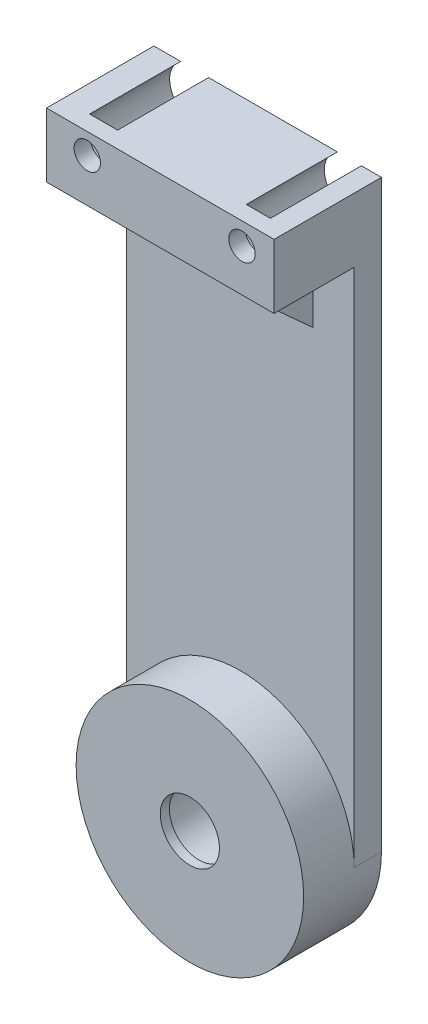
from build123d import *

# Parameters (mm, degrees)
ESBO_O2_R                           = 12.5
RESSALTO_EXTRUS_O1_DEPTH            = 5.55
RESSALTO_EXTRUS_O3_DEPTH            = 3
ESBO_O5_W                           = 25
ESBO_O5_H                           = 7.051040728
RESSALTO_EXTRUS_O4_DEPTH            = 11.8
REBAIXO_PARA_SHCS_M2_51_D           = 2.9
REBAIXO_PARA_SHCS_M2_51_CBORE_D     = 5.5
REBAIXO_PARA_SHCS_M2_51_CBORE_DEPTH = 10
NERVURA1_REACH                      = 67.976
ESBO_O10_WALL_W                     = 145.845066172
ESBO_O10_WALL_H                     = 15
CORTE_EXTRUS_O1_REACH               = 68.009
ESBO_O11_W                          = 9
ESBO_O11_H                          = 8
ESBO_O12_R                          = 3.25
CORTE_EXTRUS_O2_DEPTH               = 67.475439137
ESBO_O13_R                          = 4
CORTE_EXTRUS_O3_DEPTH               = 7.55


with BuildPart() as part:
    # Esboço2 → Ressalto-extrusão1 (new body)
    with BuildSketch(Plane.XY):
        with Locations((-0.474928023, -0.063425095)):
            Circle(ESBO_O2_R)
    extrude(amount=-RESSALTO_EXTRUS_O1_DEPTH)

    # Esboço4 → Ressalto-extrusão3 (add)
    with BuildSketch(Plane(origin=(0, 0, -5.55), x_dir=(-1, 0, 0), z_dir=(0, 0, -1))):
        with BuildLine():
            Line((-12.025071977, -0.063425095), (-12.025071977, 64.120162595))
            Line((-12.025071977, 64.120162595), (12.974928023, 64.120162595))
            Line((12.974928023, 64.120162595), (12.974928023, -0.063425095))
            ThreePointArc((12.974928023, -0.063425095), (0.474928023, -12.563425095), (-12.025071977, -0.063425095))
        make_face()
    extrude(amount=RESSALTO_EXTRUS_O3_DEPTH)

    # Esboço5 → Ressalto-extrusão4 (add)
    with BuildSketch(Plane(origin=(0, 0, -8.55), x_dir=(-1, 0, 0), z_dir=(0, 0, -1))):
        with Locations((0.474928023, 60.594642231)):
            Rectangle(ESBO_O5_W, ESBO_O5_H)
    extrude(amount=-RESSALTO_EXTRUS_O4_DEPTH)

    # Rebaixo para SHCS M2.51 (through all)
    with Locations(Plane(origin=(0, 0, -8.55), x_dir=(-1, 0, 0), z_dir=(0, 0, -1))):
        with Locations((-8.49949915, 61.707782077), (8.5, 61.838275999)):
            CounterBoreHole(REBAIXO_PARA_SHCS_M2_51_D / 2, REBAIXO_PARA_SHCS_M2_51_CBORE_D / 2, REBAIXO_PARA_SHCS_M2_51_CBORE_DEPTH)

    # Esboço10 wall → Nervura1 (add, up to next)
    with BuildSketch(Plane(origin=(0, 53.069121867, -1.15), x_dir=(0, -0.672672793996, -0.739940073396), z_dir=(0, 0.739940073396, -0.672672793996)), mode=Mode.PRIVATE) as nervura1_sk1:
        Rectangle(ESBO_O10_WALL_W, ESBO_O10_WALL_H)
    nervura1_tool1 = extrude(nervura1_sk1.sketch, amount=NERVURA1_REACH, mode=Mode.PRIVATE) - part.part
    add(nervura1_tool1.solids().sort_by_distance((0, 53.069121867, -1.15))[0])

    # Esboço11 → Corte-extrusão1 (cut, up to next)
    with BuildSketch(Plane.XY.offset(-5.55), mode=Mode.PRIVATE) as corte_extrus_o1_sk1:
        with Locations((0, 53.069121867)):
            Rectangle(ESBO_O11_W, ESBO_O11_H)
    corte_extrus_o1_tool1 = extrude(corte_extrus_o1_sk1.sketch, amount=CORTE_EXTRUS_O1_REACH, mode=Mode.PRIVATE) & part.part
    add(corte_extrus_o1_tool1.solids().sort_by_distance((0, 53.069122, -5.55))[0], mode=Mode.SUBTRACT)

    # Esboço12 → Corte-extrusão2 (cut, through all)
    with BuildSketch(Plane(origin=(0, 0, -8.55), x_dir=(-1, 0, 0), z_dir=(0, 0, -1))):
        with Locations((0.474928023, -0.063425095)):
            Circle(ESBO_O12_R)
    extrude(amount=-CORTE_EXTRUS_O2_DEPTH, mode=Mode.SUBTRACT)

    # Esboço13 → Corte-extrusão3 (cut)
    with BuildSketch(Plane(origin=(0, 0, -8.55), x_dir=(-1, 0, 0), z_dir=(0, 0, -1))):
        with Locations((0.474928023, -0.063425095)):
            Circle(ESBO_O13_R)
    extrude(amount=-CORTE_EXTRUS_O3_DEPTH, mode=Mode.SUBTRACT)


solid = part.part
